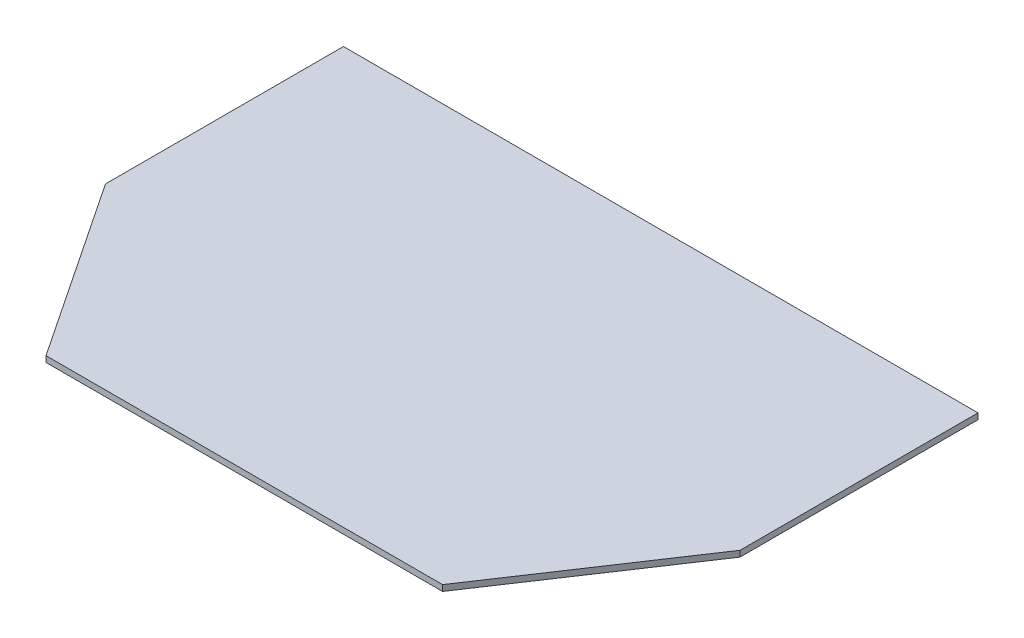
from build123d import *

# Parameters (mm, degrees)
BOSS_EXTRUDE1_DEPTH = 3


with BuildPart() as part:
    # Sketch1 → Boss-Extrude1 (new body)
    with BuildSketch(Plane(origin=(0, 0, 0), x_dir=(1, 0, 0), z_dir=(0, 1, 0))):
        Polygon((160, 60), (-160, 60), (-160, -60), (-100, -150), (100, -150), (160, -60), align=None)
    extrude(amount=BOSS_EXTRUDE1_DEPTH)


solid = part.part
